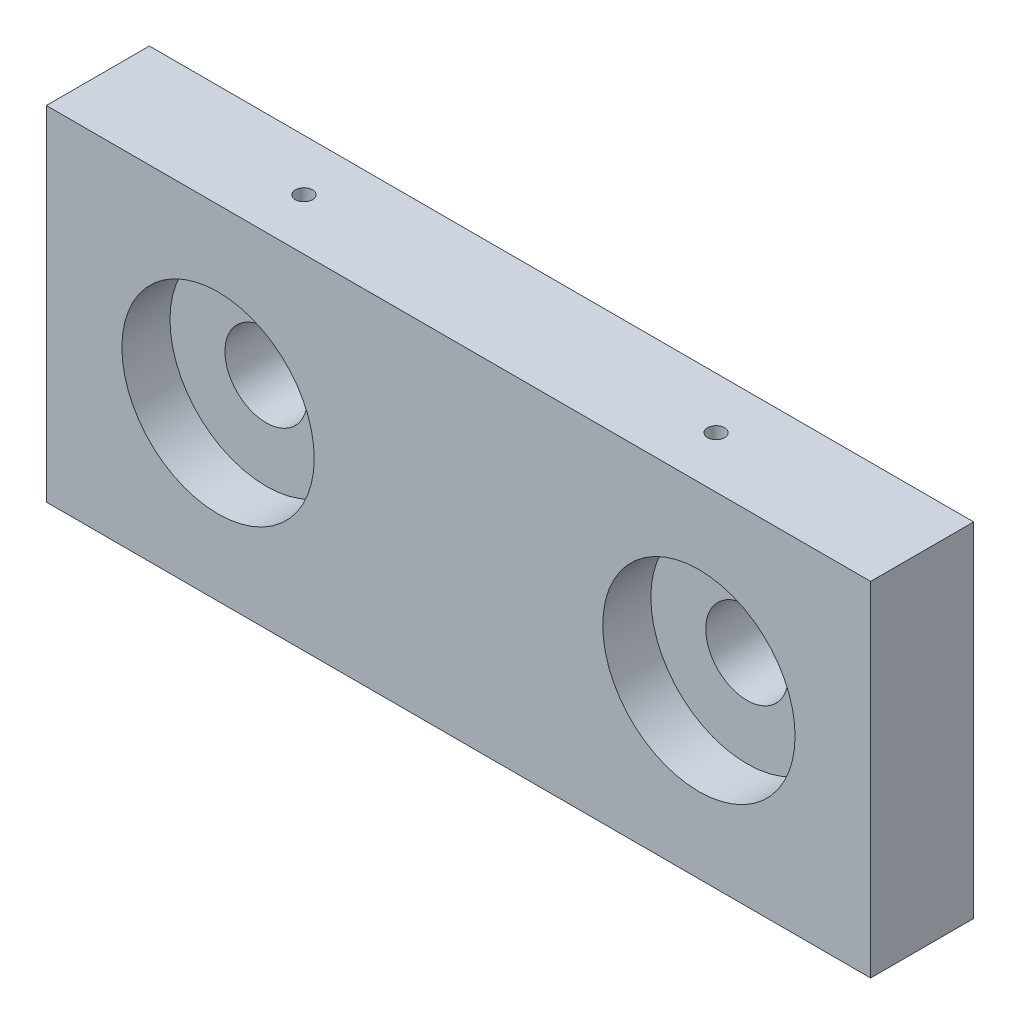
from build123d import *

# Parameters (mm, degrees)
SKETCH_1_W             = 120
SKETCH_1_H             = 50
EXTRUDE_1_DEPTH        = 15
CUT_EXTRUDE_1_REACH    = 68.708
SKETCH_2_R             = 6
HOLE_WIZARD_M3_1_D     = 2.5
HOLE_WIZARD_M3_1_DEPTH = 5
HOLE_WIZARD_M3_1_TIP   = 0.751075774
HOLE_WIZARD_M3_2_D     = 2.5
HOLE_WIZARD_M3_2_DEPTH = 5
HOLE_WIZARD_M3_2_TIP   = 0.751075774
SKETCH_19_R            = 14
CUT_EXTRUDE_3_DEPTH    = 7


with BuildPart() as part:
    # 草图1 → 凸台-拉伸1 (new body)
    with BuildSketch(Plane.XY):
        Rectangle(SKETCH_1_W, SKETCH_1_H)
    extrude(amount=EXTRUDE_1_DEPTH)

    # 草图2 → 切除-拉伸1 (cut, up to next)
    with BuildSketch(Plane.XY.offset(15), mode=Mode.PRIVATE) as cut_extrude_1_sk1:
        with Locations((-35, 0)):
            Circle(SKETCH_2_R)
    cut_extrude_1_tool1 = extrude(cut_extrude_1_sk1.sketch, amount=-CUT_EXTRUDE_1_REACH, mode=Mode.PRIVATE) & part.part
    # 草图2 → 切除-拉伸1 (cut, up to next)
    with BuildSketch(Plane.XY.offset(15), mode=Mode.PRIVATE) as cut_extrude_1_sk2:
        with Locations((35, 0)):
            Circle(SKETCH_2_R)
    cut_extrude_1_tool2 = extrude(cut_extrude_1_sk2.sketch, amount=-CUT_EXTRUDE_1_REACH, mode=Mode.PRIVATE) & part.part
    add(cut_extrude_1_tool1.solids().sort_by_distance((-35, 0, 15))[0], mode=Mode.SUBTRACT)
    add(cut_extrude_1_tool2.solids().sort_by_distance((35, 0, 15))[0], mode=Mode.SUBTRACT)

    # M3 螺纹孔1
    with Locations(Plane(origin=(0, 25, 0), x_dir=(1, 0, 0), z_dir=(0, 1, 0))):
        with Locations((30, -7.5), (-30, -7.5)):
            Hole(HOLE_WIZARD_M3_1_D / 2, depth=HOLE_WIZARD_M3_1_DEPTH)
            with Locations((0, 0, -(HOLE_WIZARD_M3_1_DEPTH + HOLE_WIZARD_M3_1_TIP / 2))):  # 118° drill point
                Cone(0, HOLE_WIZARD_M3_1_D / 2, HOLE_WIZARD_M3_1_TIP, mode=Mode.SUBTRACT)

    # M3 螺纹孔2
    with Locations(Plane(origin=(0, -25, 0), x_dir=(-1, 0, 0), z_dir=(0, -1, 0))):
        with Locations((-30, -7.5), (30, -7.5)):
            Hole(HOLE_WIZARD_M3_2_D / 2, depth=HOLE_WIZARD_M3_2_DEPTH)
            with Locations((0, 0, -(HOLE_WIZARD_M3_2_DEPTH + HOLE_WIZARD_M3_2_TIP / 2))):  # 118° drill point
                Cone(0, HOLE_WIZARD_M3_2_D / 2, HOLE_WIZARD_M3_2_TIP, mode=Mode.SUBTRACT)

    # 草图19 → 切除-拉伸3 (cut)
    with BuildSketch(Plane.XY.offset(15)):
        with Locations((-35, 0)):
            Circle(SKETCH_19_R)
        with Locations((35, 0)):
            Circle(SKETCH_19_R)
    extrude(amount=-CUT_EXTRUDE_3_DEPTH, mode=Mode.SUBTRACT)


solid = part.part
